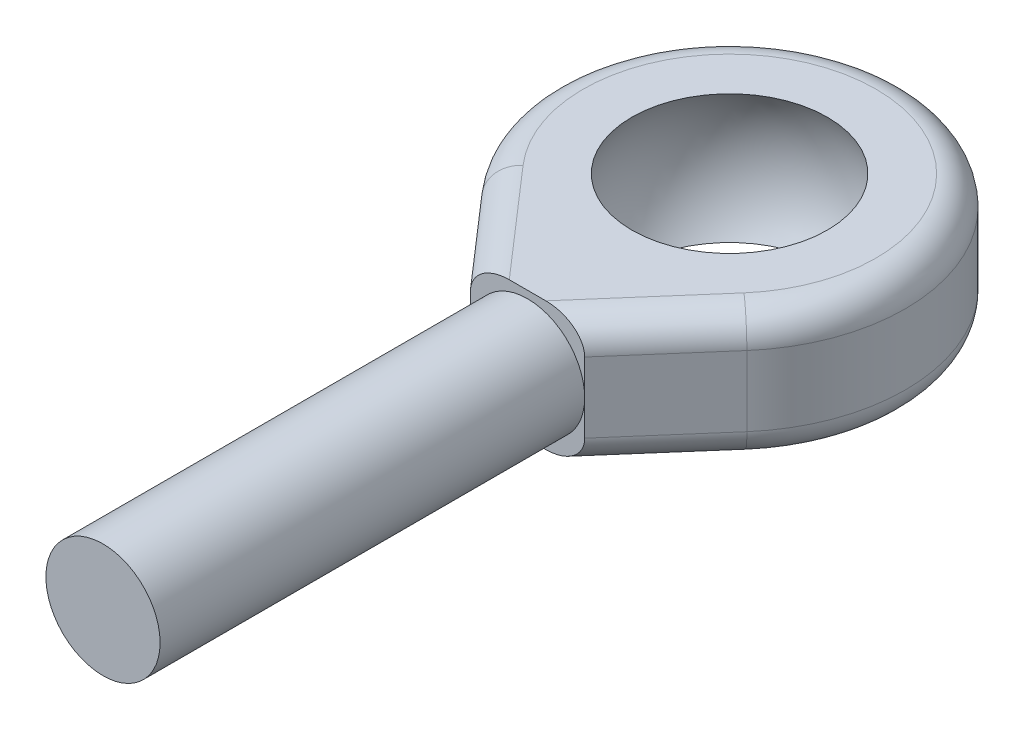
from build123d import *

# Parameters (mm, degrees)
SKETCH1_R             = 12
BOSS_EXTRUDE1_DEPTH   = 8.8
BOSS_EXTRUDE2_START   = -8.8
BOSS_EXTRUDE2_DEPTH   = 8.8
BOSS_EXTRUDE3_DEPTH   = 8.8
BOSS_EXTRUDE3_2_DEPTH = 8.8
BOSS_EXTRUDE4_START   = 8.8
BOSS_EXTRUDE4_DEPTH   = 8.8
CUT_EXTRUDE3_START    = -8.8
CUT_EXTRUDE3_DEPTH    = 8.8
CUT_EXTRUDE4_DEPTH    = 29
FILLET1_R             = 2


with BuildPart() as part:
    # Sketch1 → Boss-Extrude1 (new body)
    with BuildSketch(Plane(origin=(0, 0, 0), x_dir=(1, 0, 0), z_dir=(0, 1, 0))):
        with Locations(Location((0, 0, 0), (0, 0, 270))):
            Circle(SKETCH1_R)
    extrude(amount=BOSS_EXTRUDE1_DEPTH)

    # Sketch2 → Cut-Revolve1 (revolve, cut)
    with BuildSketch(Plane(origin=(0, 4.4, 0), x_dir=(1, 0, 0), z_dir=(0, 1, 0))):
        with BuildLine():
            Line((-8, 0), (8, 0))
            ThreePointArc((8, 0), (0, 8), (-8, 0))
        make_face()
    revolve(axis=Axis((-8, 4.4, 0), (1, 0, 0)), mode=Mode.SUBTRACT)

    # Sketch3 → Boss-Extrude2 (add)
    with BuildSketch(Plane(origin=(0, 8.8, 0), x_dir=(1, 0, 0), z_dir=(0, 1, 0)).offset(BOSS_EXTRUDE2_START)):
        with BuildLine():
            Line((0, -12), (0, -42.8))
            Line((0, -42.8), (3.9, -42.8))
            Line((3.9, -42.8), (3.9, -11.348568192))
            ThreePointArc((3.9, -11.348568192), (1.977015642, -11.836021677), (0, -12))
        make_face()
        with BuildLine():
            Line((-3.9, -11.348568192), (-3.9, -42.8))
            Line((-3.9, -42.8), (0, -42.8))
            Line((0, -42.8), (0, -12))
            ThreePointArc((0, -12), (-1.977015642, -11.836021677), (-3.9, -11.348568192))
        make_face()
    extrude(amount=BOSS_EXTRUDE2_DEPTH)



with BuildPart() as body_2:
    # Sketch4 → Boss-Extrude3 (new body)
    with BuildSketch(Plane(origin=(0, 8.8, 0), x_dir=(1, 0, 0), z_dir=(0, 1, 0))):
        with BuildLine():
            Line((-9.05348909, -7.876187866), (-3.9, -13.8))
            Line((-3.9, -13.8), (-3.9, -11.348568192))
            ThreePointArc((-3.9, -11.348568192), (-6.705413946, -9.951754811), (-9.05348909, -7.876187866))
        make_face()
    extrude(amount=BOSS_EXTRUDE3_DEPTH)


with BuildPart() as body_3:
    # Sketch4 → Boss-Extrude3 2 (new body)
    with BuildSketch(Plane(origin=(0, 8.8, 0), x_dir=(1, 0, 0), z_dir=(0, 1, 0))):
        with BuildLine():
            Line((3.9, -11.348568192), (3.9, -13.8))
            Line((3.9, -13.8), (9.05348909, -7.876187866))
            ThreePointArc((9.05348909, -7.876187866), (6.705413946, -9.951754811), (3.9, -11.348568192))
        make_face()
    extrude(amount=BOSS_EXTRUDE3_2_DEPTH)


with BuildPart() as part_1:
    add(part.part)

    add(body_2.part)  # Boss-Extrude4 merges body 2

    add(body_3.part)  # Boss-Extrude4 merges body 3
    # Sketch5 → Boss-Extrude4 (add)
    with BuildSketch(Plane.XZ.offset(-8.8).offset(BOSS_EXTRUDE4_START)):
        with BuildLine():
            Line((-3.9, 11.348568192), (-3.9, 13.8))
            Line((-3.9, 13.8), (-9.05348909, 7.876187866))
            ThreePointArc((-9.05348909, 7.876187866), (-6.705413946, 9.951754811), (-3.9, 11.348568192))
        make_face()
        with BuildLine():
            Line((9.05348909, 7.876187866), (3.9, 13.8))
            Line((3.9, 13.8), (3.9, 11.348568192))
            ThreePointArc((3.9, 11.348568192), (6.705413946, 9.951754811), (9.05348909, 7.876187866))
        make_face()
    extrude(amount=-BOSS_EXTRUDE4_DEPTH)

    # Sketch6 → Cut-Extrude3 (cut)
    with BuildSketch(Plane(origin=(0, 17.6, 0), x_dir=(1, 0, 0), z_dir=(0, 1, 0)).offset(CUT_EXTRUDE3_START)):
        with BuildLine():
            Line((-9.05348909, -7.876187866), (-3.9, -13.8))
            Line((-3.9, -13.8), (-3.9, -11.348568192))
            ThreePointArc((-3.9, -11.348568192), (-6.705413946, -9.951754811), (-9.05348909, -7.876187866))
        make_face()
        with BuildLine():
            Line((3.9, -13.8), (9.05348909, -7.876187866))
            ThreePointArc((9.05348909, -7.876187866), (6.705413946, -9.951754811), (3.9, -11.348568192))
            Line((3.9, -11.348568192), (3.9, -13.8))
        make_face()
    extrude(amount=CUT_EXTRUDE3_DEPTH, mode=Mode.SUBTRACT)

    # Sketch7 → Cut-Extrude4 (cut)
    with BuildSketch(Plane.XY.offset(42.8)):
        with BuildLine():
            Line((3.9, 8.8), (0, 8.8))
            Line((0, 8.8), (0, 8.3))
            ThreePointArc((0, 8.3), (2.757716447, 7.157716447), (3.9, 4.4))
            Line((3.9, 4.4), (3.9, 8.8))
        make_face()
        with BuildLine():
            ThreePointArc((3.9, 4.4), (2.757716447, 1.642283553), (0, 0.5))
            Line((0, 0.5), (0, 0))
            Line((0, 0), (3.9, 0))
            Line((3.9, 0), (3.9, 4.4))
        make_face()
        with BuildLine():
            Line((0, 8.3), (0, 8.8))
            Line((0, 8.8), (-3.9, 8.8))
            Line((-3.9, 8.8), (-3.9, 4.4))
            ThreePointArc((-3.9, 4.4), (-2.757716447, 7.157716447), (0, 8.3))
        make_face()
        with BuildLine():
            Line((0, 0), (0, 0.5))
            ThreePointArc((0, 0.5), (-2.757716447, 1.642283553), (-3.9, 4.4))
            Line((-3.9, 4.4), (-3.9, 0))
            Line((-3.9, 0), (0, 0))
        make_face()
    extrude(amount=-CUT_EXTRUDE4_DEPTH, mode=Mode.SUBTRACT)

    # Fillet1
    fillet1_edges = [part_1.edges().sort_by_distance(p)[0] for p in [
        (0, 0, -12),
        (0, 8.8, -12),
        (6.476744545, 0, 10.838093933),
        (-6.476744545, 0, 10.838093933),
        (6.476744545, 8.8, 10.838093933),
        (-6.476744545, 8.8, 10.838093933),
    ]]
    fillet(fillet1_edges, radius=FILLET1_R)


solid = part_1.part
